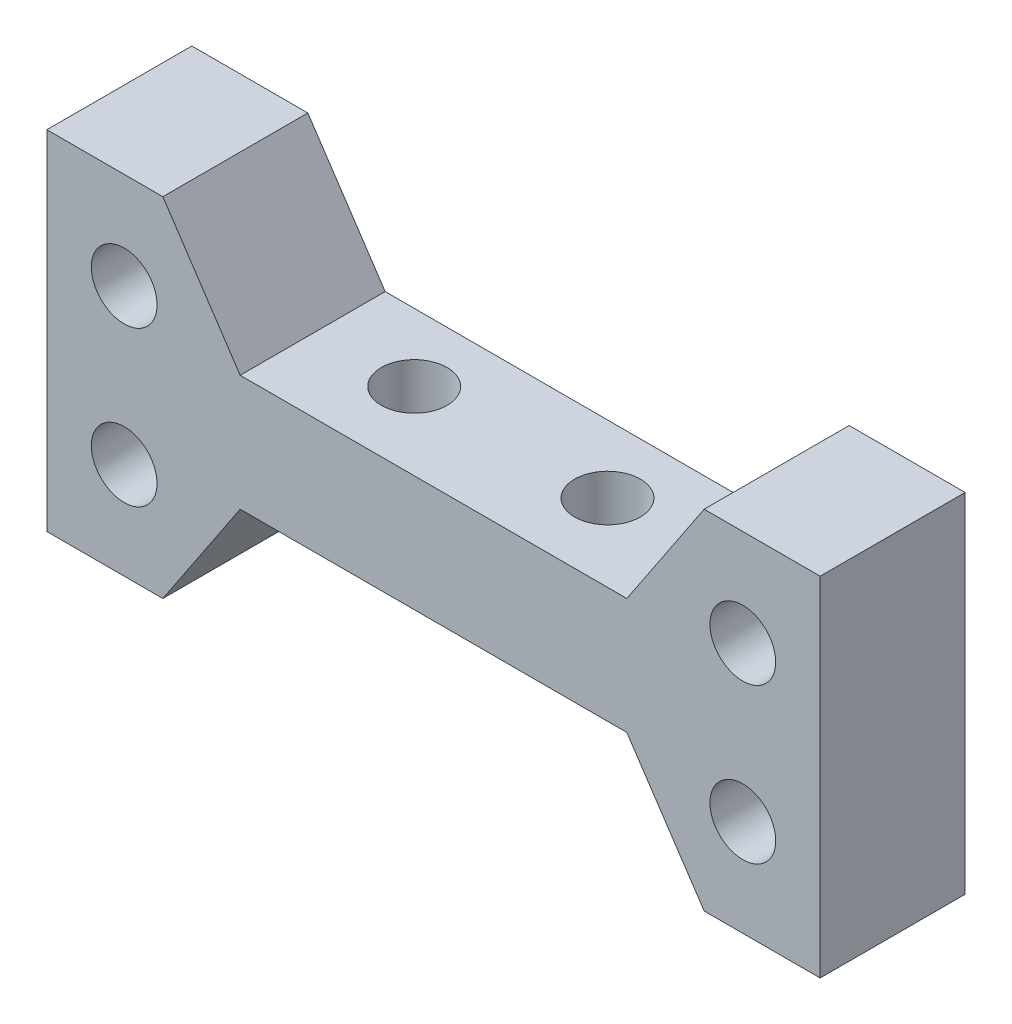
from build123d import *

# Parameters (mm, degrees)
SKETCH1_W           = 40
SKETCH1_H           = 18
BOSS_EXTRUDE1_DEPTH = 7.5
SKETCH2_R           = 1.7
CUT_EXTRUDE1_DEPTH  = 24.178653973
SKETCH3_R           = 1.7
CUT_EXTRUDE2_DEPTH  = 25.5


with BuildPart() as part:
    # Sketch1 → Boss-Extrude1 (new body)
    with BuildSketch(Plane.XY):
        Rectangle(SKETCH1_W, SKETCH1_H)
    extrude(amount=BOSS_EXTRUDE1_DEPTH)

    # Sketch2 → Cut-Extrude1 (cut, through all)
    with BuildSketch(Plane(origin=(0, 0, 0), x_dir=(-1, 0, 0), z_dir=(0, 0, -1))):
        with Locations((-16, 4)):
            Circle(SKETCH2_R)
        with Locations((-16, -4)):
            Circle(SKETCH2_R)
        with Locations((16, 4)):
            Circle(SKETCH2_R)
        with Locations((16, -4)):
            Circle(SKETCH2_R)
        Polygon((10, -3), (14, -9), (-14, -9), (-10, -3), align=None)
        Polygon((-14, 9), (-10, 3), (10, 3), (14, 9), align=None)
    extrude(amount=-CUT_EXTRUDE1_DEPTH, mode=Mode.SUBTRACT)

    # Sketch3 → Cut-Extrude2 (cut, through all)
    with BuildSketch(Plane(origin=(0, 3, 0), x_dir=(1, 0, 0), z_dir=(0, 1, 0))):
        with Locations(Location((-5, -3.5, 0), (0, 0, 270))):
            Circle(SKETCH3_R)
        with Locations(Location((5, -3.5, 0), (0, 0, 270))):
            Circle(SKETCH3_R)
    extrude(amount=-CUT_EXTRUDE2_DEPTH, mode=Mode.SUBTRACT)


solid = part.part
